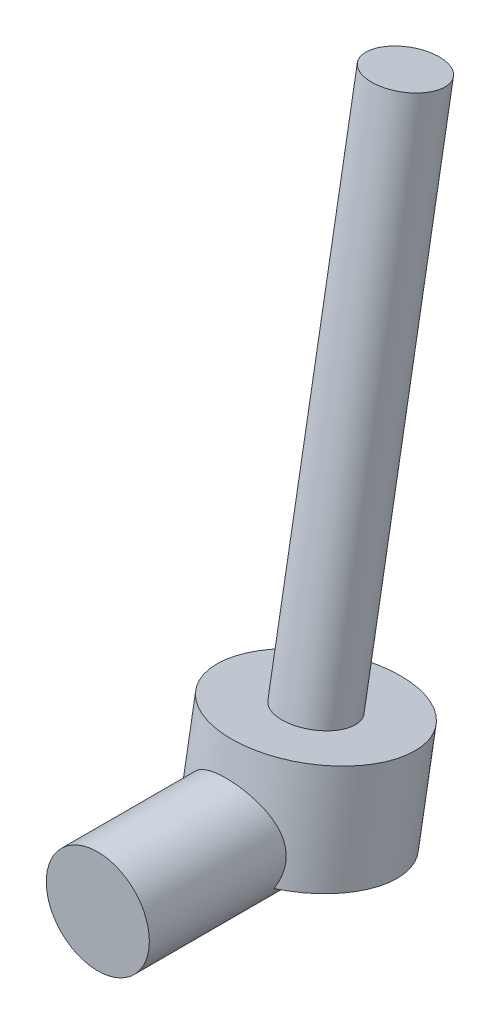
from build123d import *

# Parameters (mm, degrees)
SKETCH1_R                = 45
BOSS_EXTRUDE1_DEPTH      = 180
BOSS_EXTRUDE2_DEPTH      = 60
BOSS_EXTRUDE2_DEPTH_BACK = 30
SKETCH2_R                = 75
SKETCH3_R                = 30
BOSS_EXTRUDE3_DEPTH      = 450


with BuildPart() as part:
    # Sketch1 → Boss-Extrude1 (new body)
    with BuildSketch(Plane.XY):
        Circle(SKETCH1_R)
    extrude(amount=BOSS_EXTRUDE1_DEPTH)

    # Sketch2 → Boss-Extrude2 (add, two sides: drawn at the far end of the back side and taken through both)
    with BuildSketch(Plane(origin=(0, 0, 0), x_dir=(-1, 0, 0), z_dir=(0, 0.9848077530122081, -0.17364817766693041)).offset(-BOSS_EXTRUDE2_DEPTH_BACK)):
        Circle(SKETCH2_R)
    extrude(amount=BOSS_EXTRUDE2_DEPTH + BOSS_EXTRUDE2_DEPTH_BACK)

    # Sketch3 → Boss-Extrude3 (add)
    with BuildSketch(Plane(origin=(0, 59.088465181, -10.41889066), x_dir=(1, 0, 0), z_dir=(0, 0.9848077530122081, -0.1736481776669304))):
        Circle(SKETCH3_R)
    extrude(amount=BOSS_EXTRUDE3_DEPTH)


solid = part.part
